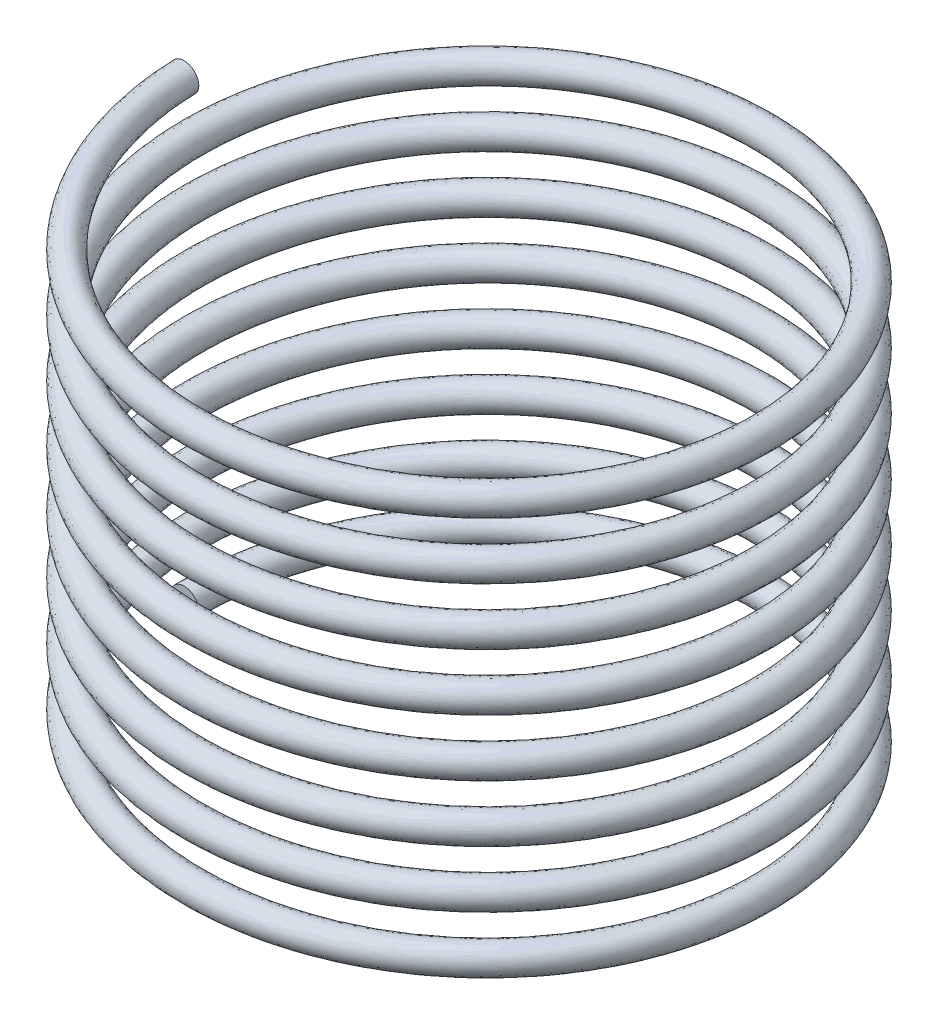
from build123d import *

# Parameters (mm, degrees)
SWEEP1_PITCH       = 10
SWEEP1_HEIGHT      = 80
SWEEP1_RADIUS      = 50
SWEEP1_START_ANGLE = -90
SWEEP1_PROFILE_R   = 2.5


with BuildPart() as part:
    # Sweep1: sweep along a helix
    with BuildLine() as sweep1_path:
        add(Helix(SWEEP1_PITCH, SWEEP1_HEIGHT, SWEEP1_RADIUS, center=(0, 0, 0), direction=(0, 1, 0), lefthand=True, mode=Mode.PRIVATE).rotate(Axis((0, 0, 0), (0, 1, 0)), SWEEP1_START_ANGLE))
    # Sweep1 profile (on start of the path) → Sweep1 (sweep)
    with BuildSketch(Plane(origin=(-50, 0, 0), x_dir=(0, -0.9994937787313611, -0.0318148750949147), z_dir=(9.981162246596828e-14, 0.0318148750949147, -0.9994937787313611))):
        Circle(SWEEP1_PROFILE_R)
    sweep(path=sweep1_path.line, is_frenet=True)


solid = part.part
